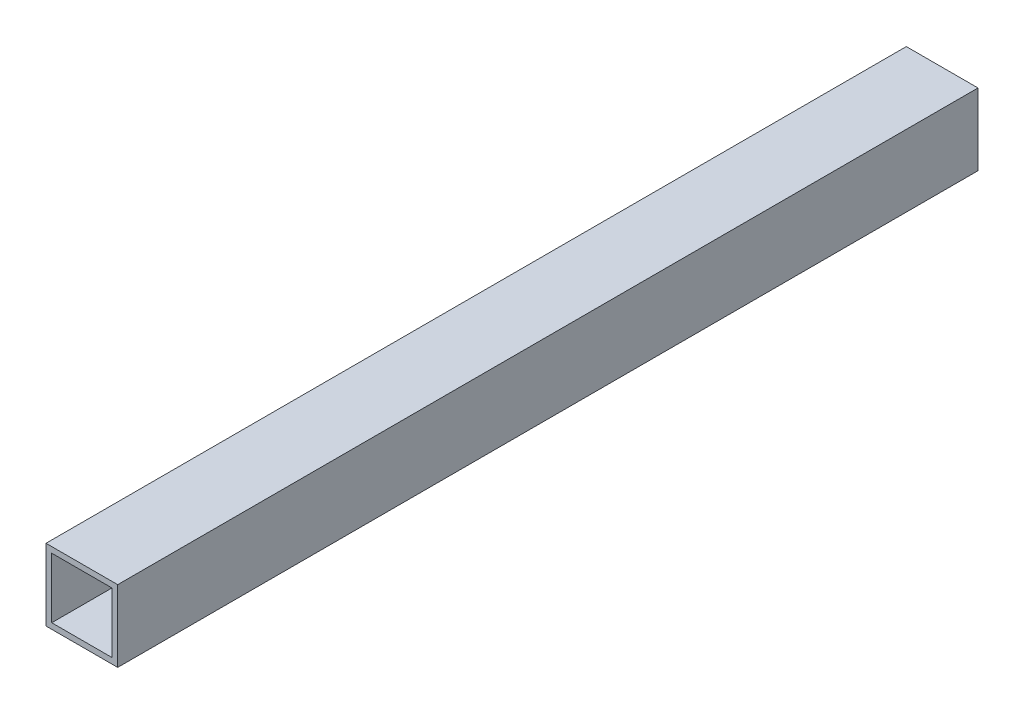
from build123d import *

# Parameters (mm, degrees)
SKETCH1_W           = 25
SKETCH1_H           = 25
SKETCH1_W_2         = 21
SKETCH1_H_2         = 21
BOSS_EXTRUDE1_DEPTH = 300


with BuildPart() as part:
    # Sketch1 → Boss-Extrude1 (new body)
    with BuildSketch(Plane.XY):
        Rectangle(SKETCH1_W, SKETCH1_H)
        Rectangle(SKETCH1_W_2, SKETCH1_H_2, mode=Mode.SUBTRACT)
    extrude(amount=BOSS_EXTRUDE1_DEPTH)


solid = part.part
